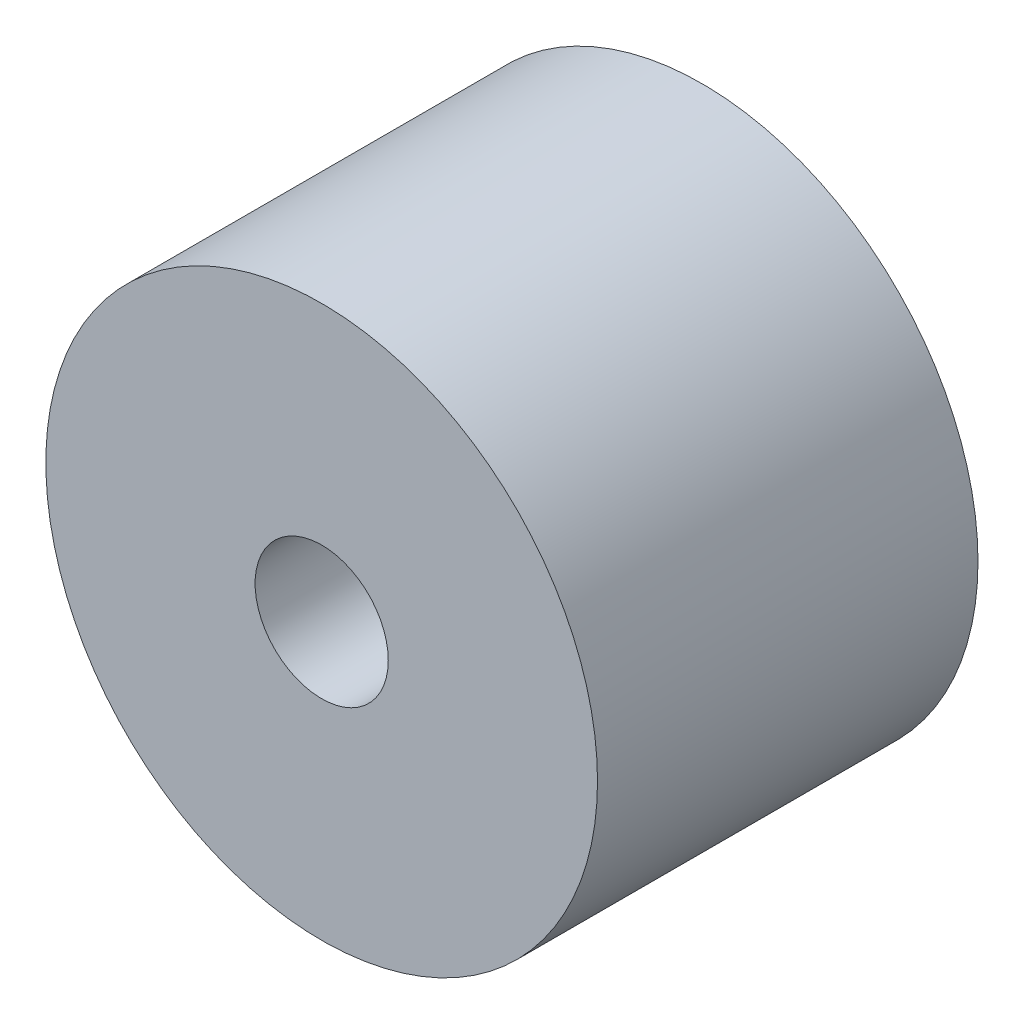
from build123d import *

# Parameters (mm, degrees)
CROQUIS1_R              = 14.5
CROQUIS1_R_2            = 3.5
SALIENTE_EXTRUIR1_DEPTH = 20


with BuildPart() as part:
    # Croquis1 → Saliente-Extruir1 (new body)
    with BuildSketch(Plane.XY):
        Circle(CROQUIS1_R)
        Circle(CROQUIS1_R_2, mode=Mode.SUBTRACT)
    extrude(amount=SALIENTE_EXTRUIR1_DEPTH)


solid = part.part
